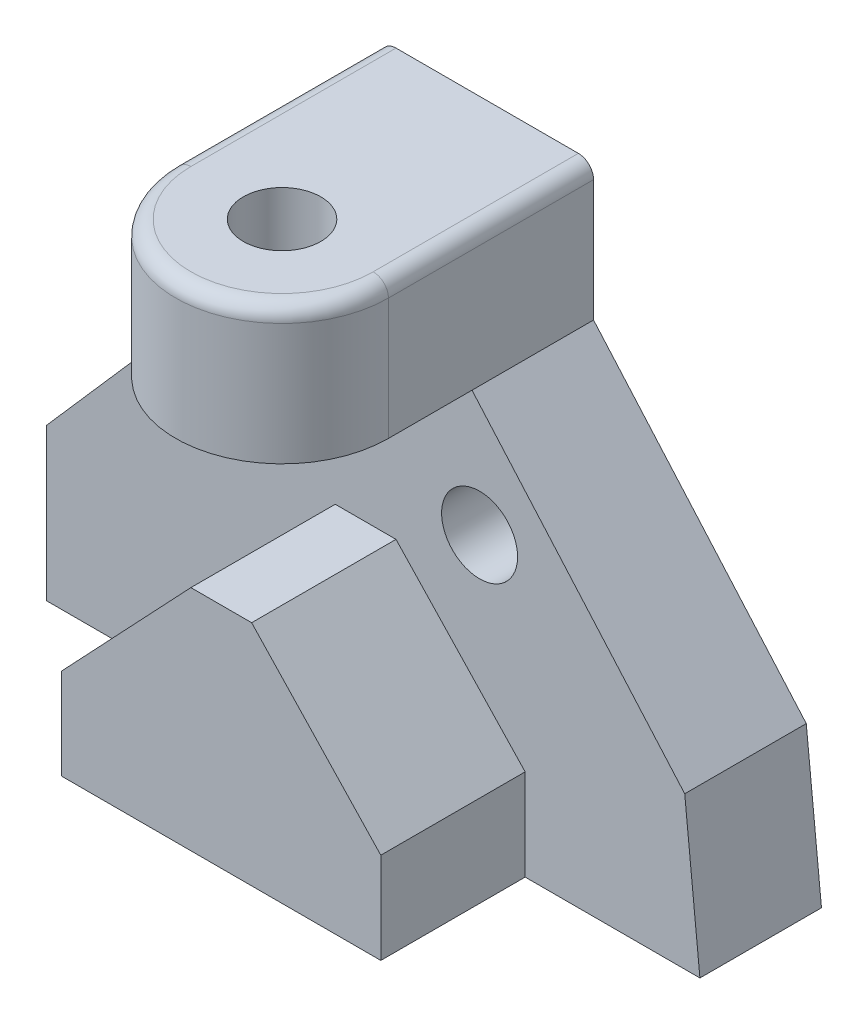
from build123d import *

# Parameters (mm, degrees)
EXTRUDE_1_DEPTH         = 16
EXTRUDE_2_DEPTH         = 19
EXTRUDE_3_DEPTH         = 18
FILLET_1_R              = 2
HOLE_WIZARD_M12_1_D     = 10.2
HOLE_WIZARD_M12_1_DEPTH = 18
HOLE_WIZARD_10_0_10_1_D = 10


with BuildPart() as part:
    # 草图1 → 凸台-拉伸1 (new body)
    with BuildSketch(Plane.XY):
        Polygon((14, 32), (-14, 32), (-42, 0), (-42, -20), (44, -20), (42, 0), align=None)
    extrude(amount=EXTRUDE_1_DEPTH)

    # 草图2 → 凸台-拉伸2 (add)
    with BuildSketch(Plane.XY.offset(16)):
        Polygon((4, 10), (-4, 10), (-21, -8), (-21, -20), (21, -20), (21, -8), align=None)
    extrude(amount=EXTRUDE_2_DEPTH)

    # 草图5 → 凸台-拉伸3 (add)
    with BuildSketch(Plane(origin=(0, 32, 0), x_dir=(1, 0, 0), z_dir=(0, 1, 0))):
        with BuildLine():
            Line((-14, 0), (-14, -27))
            ThreePointArc((-14, -27), (0, -41), (14, -27))
            Line((14, -27), (14, 0))
            Line((14, 0), (-14, 0))
        make_face()
    extrude(amount=EXTRUDE_3_DEPTH)

    # 圆角1
    fillet_1_edges = [part.edges().sort_by_distance(p)[0] for p in [
        (0, 50, 41),
        (14, 50, 13.5),
        (-14, 50, 13.5),
    ]]
    fillet(fillet_1_edges, radius=FILLET_1_R)

    # M12 螺纹孔1
    with Locations(Plane(origin=(0, 50, 0), x_dir=(1, 0, 0), z_dir=(0, 1, 0))):
        with Locations((0, -27)):
            Hole(HOLE_WIZARD_M12_1_D / 2, depth=HOLE_WIZARD_M12_1_DEPTH)

    # Ø10.0 (10) 直径孔1 (through all)
    with Locations(Plane.XY.offset(16)):
        with Locations((-15, 16), (15, 16)):
            Hole(HOLE_WIZARD_10_0_10_1_D / 2)


solid = part.part
